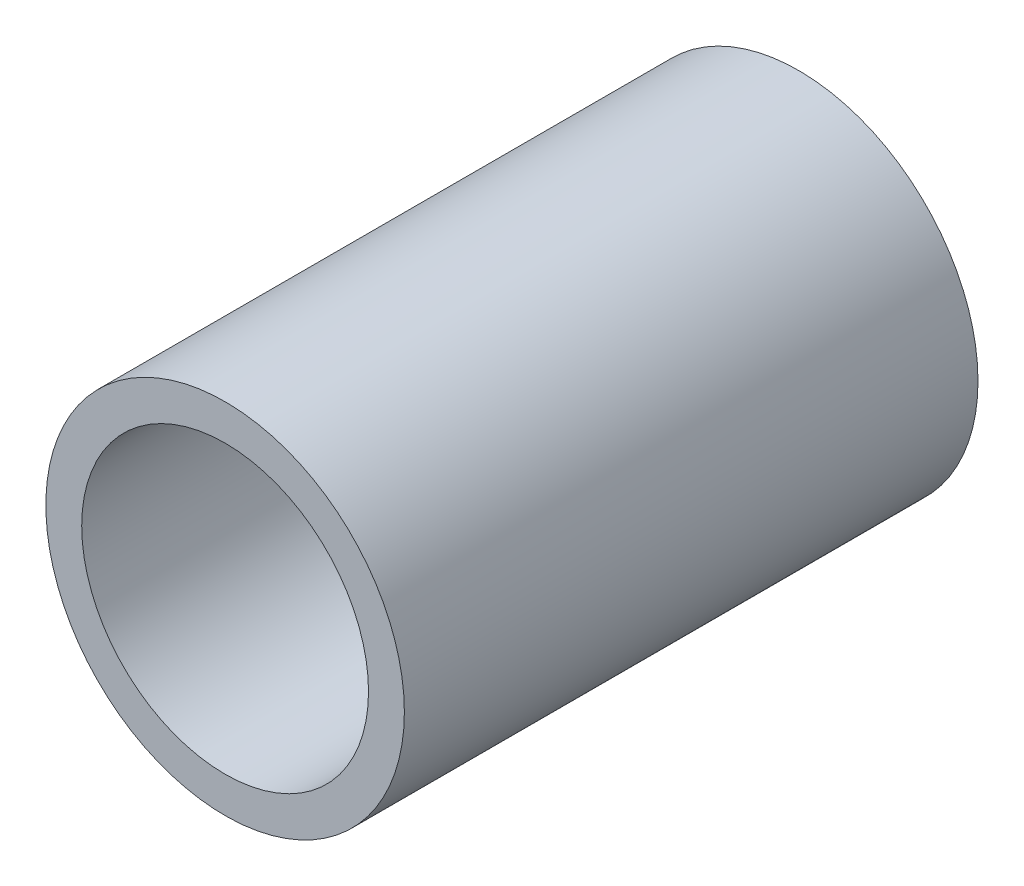
from build123d import *

# Parameters (mm, degrees)
SKETCH1_R           = 3.96875
BOSS_EXTRUDE1_DEPTH = 12.7
SKETCH2_R           = 3.175
CUT_EXTRUDE1_DEPTH  = 14.8849542


with BuildPart() as part:
    # Sketch1 → Boss-Extrude1 (new body)
    with BuildSketch(Plane.XY):
        Circle(SKETCH1_R)
    extrude(amount=BOSS_EXTRUDE1_DEPTH)

    # Sketch2 → Cut-Extrude1 (cut, through all)
    with BuildSketch(Plane.XY.offset(12.7)):
        Circle(SKETCH2_R)
    extrude(amount=-CUT_EXTRUDE1_DEPTH, mode=Mode.SUBTRACT)


solid = part.part
